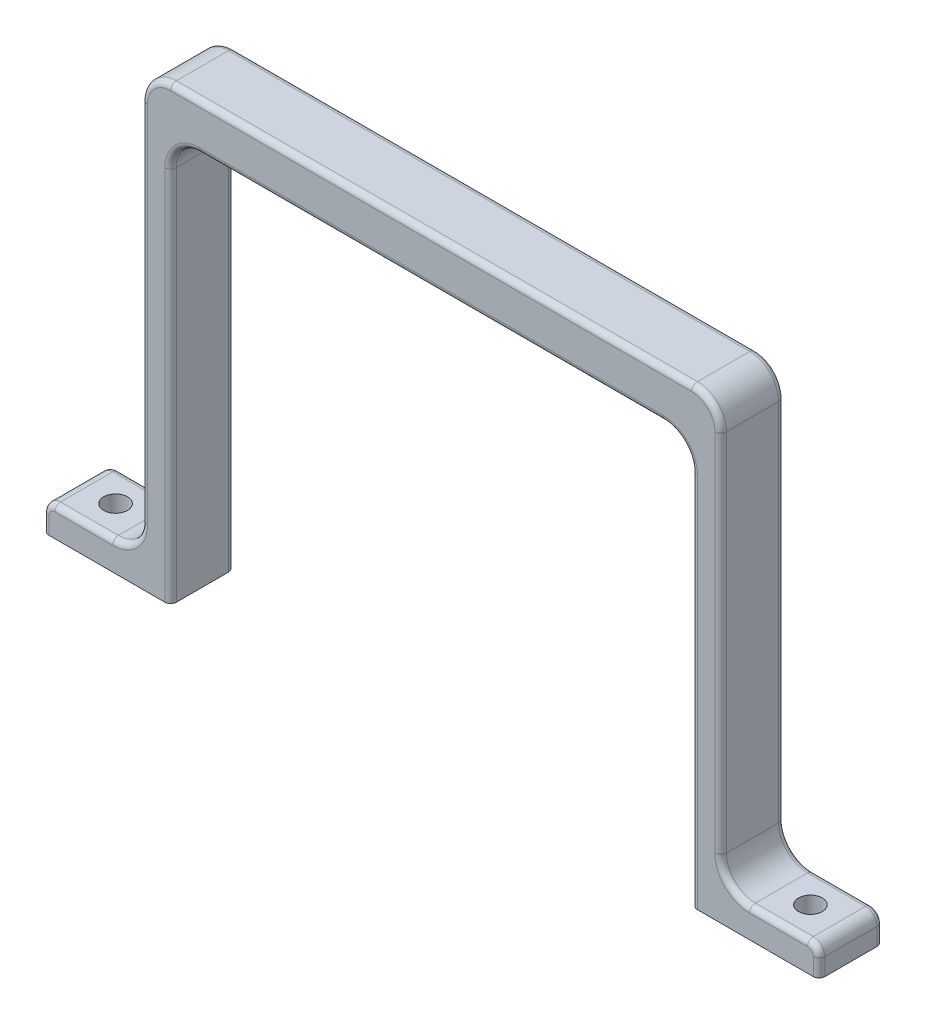
from build123d import *

# Parameters (mm, degrees)
BOSS_EXTRU_1_DEPTH      = 11
CONG_1_R                = 1
ESQUISSE2_R             = 3.2
ENL_V_MAT_EXTRU_1_DEPTH = 5
ESQUISSE3_R             = 2.05
ENL_V_MAT_EXTRU_2_DEPTH = 100.694533451


with BuildPart() as part:
    # Esquisse1 → Boss.-Extru.1 (new body)
    with BuildSketch(Plane.XY):
        with BuildLine():
            Line((-67, 0), (-45, 0))
            Line((-45, 0), (-45, 65))
            ThreePointArc((-45, 65), (-43.535533906, 68.535533906), (-40, 70))
            Line((-40, 70), (40, 70))
            ThreePointArc((40, 70), (43.535533906, 68.535533906), (45, 65))
            Line((45, 65), (45, 0))
            Line((45, 0), (67, 0))
            Line((67, 0), (67, 3))
            ThreePointArc((67, 3), (66.414213562, 4.414213562), (65, 5))
            Line((65, 5), (55, 5))
            ThreePointArc((55, 5), (51.464466094, 6.464466094), (50, 10))
            Line((50, 10), (50, 73))
            ThreePointArc((50, 73), (48.535533906, 76.535533906), (45, 78))
            Line((45, 78), (-45, 78))
            ThreePointArc((-45, 78), (-48.535533906, 76.535533906), (-50, 73))
            Line((-50, 73), (-50, 10))
            ThreePointArc((-50, 10), (-51.464466094, 6.464466094), (-55, 5))
            Line((-55, 5), (-65, 5))
            ThreePointArc((-65, 5), (-66.414213562, 4.414213562), (-67, 3))
            Line((-67, 3), (-67, 0))
        make_face()
    extrude(amount=BOSS_EXTRU_1_DEPTH)

    # Congé1
    cong_1_edges = [part.edges().sort_by_distance(p)[0] for p in [
        (-66.414213562, 4.414213562, 11),
        (-67, 1.5, 11),
        (-50, 41.5, 0),
        (-48.535533906, 76.535533906, 0),
        (0, 78, 0),
        (48.535533906, 76.535533906, 0),
        (50, 41.5, 0),
        (51.464466094, 6.464466094, 0),
        (60, 5, 0),
        (66.414213562, 4.414213562, 0),
        (67, 1.5, 0),
        (45, 32.5, 0),
        (43.535533906, 68.535533906, 0),
        (0, 70, 0),
        (-43.535533906, 68.535533906, 0),
        (-45, 32.5, 11),
        (-45, 32.5, 0),
        (-67, 1.5, 0),
        (-66.414213562, 4.414213562, 0),
        (-60, 5, 0),
        (-51.464466094, 6.464466094, 0),
        (-43.535533906, 68.535533906, 11),
        (0, 70, 11),
        (43.535533906, 68.535533906, 11),
        (45, 32.5, 11),
        (67, 1.5, 11),
        (-51.464466094, 6.464466094, 11),
        (66.414213562, 4.414213562, 11),
        (60, 5, 11),
        (51.464466094, 6.464466094, 11),
        (50, 41.5, 11),
        (48.535533906, 76.535533906, 11),
        (0, 78, 11),
        (-48.535533906, 76.535533906, 11),
        (-50, 41.5, 11),
        (-60, 5, 11),
    ]]
    fillet(cong_1_edges, radius=CONG_1_R)

    # Esquisse2 → Enlèv. mat.-Extru.1 (cut)
    with BuildSketch(Plane.XZ.offset(-70)):
        with Locations(Location((-33.5, 5.5, 0), (0, 0, 270))):
            Circle(ESQUISSE2_R)
        with Locations(Location((33.5, 5.5, 0), (0, 0, 270))):
            Circle(ESQUISSE2_R)
    extrude(amount=-ENL_V_MAT_EXTRU_1_DEPTH, mode=Mode.SUBTRACT)

    # Esquisse3 → Enlèv. mat.-Extru.2 (cut, through all)
    with BuildSketch(Plane(origin=(0, 5, 0), x_dir=(1, 0, 0), z_dir=(0, 1, 0))):
        with Locations(Location((-60, -5.5, 0), (0, 0, 180))):
            Circle(ESQUISSE3_R)
        with Locations(Location((60, -5.5, 0), (0, 0, 180))):
            Circle(ESQUISSE3_R)
    extrude(amount=-ENL_V_MAT_EXTRU_2_DEPTH, mode=Mode.SUBTRACT)


solid = part.part
